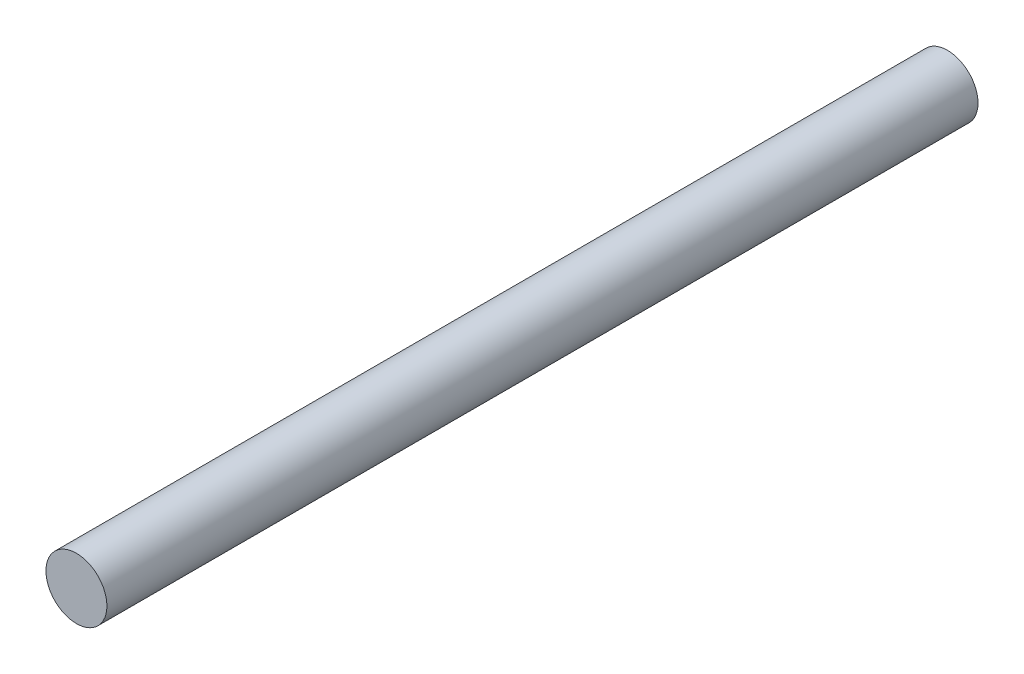
from build123d import *

# Parameters (mm, degrees)
ESQUISSE2_R        = 2
BOSS_EXTRU_1_DEPTH = 28.575


with BuildPart() as part:
    # Esquisse2 → Boss.-Extru.1 (new, symmetric)
    with BuildSketch(Plane.XY):
        Circle(ESQUISSE2_R)
    extrude(amount=BOSS_EXTRU_1_DEPTH, both=True)


solid = part.part
